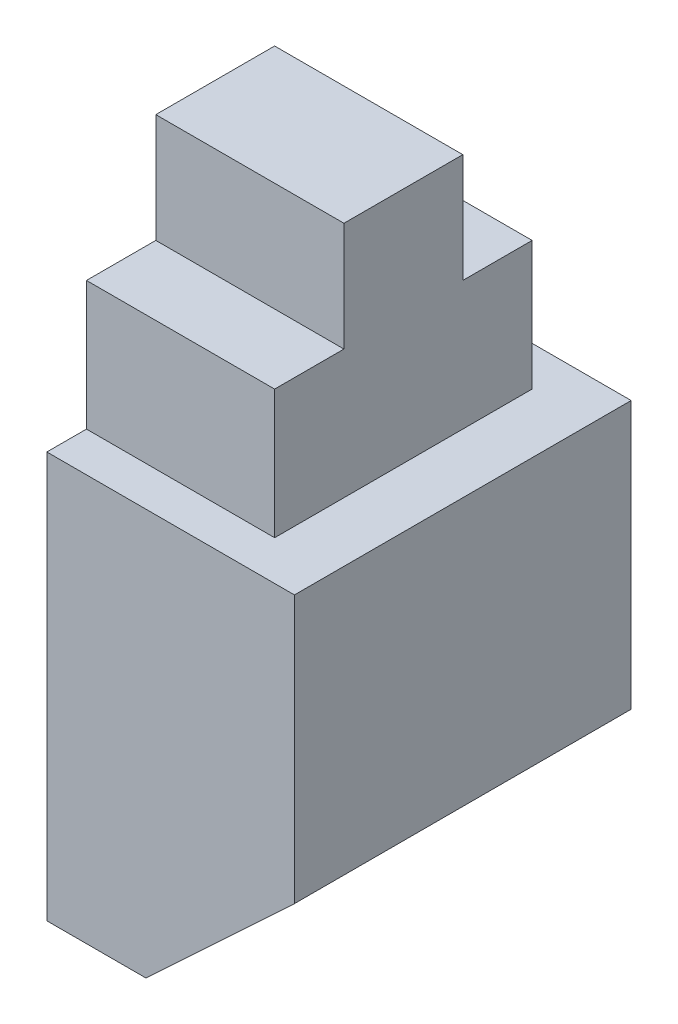
from build123d import *

# Parameters (mm, degrees)
BOSS_EXTRUDE1_DEPTH = 34
BOSS_EXTRUDE2_DEPTH = 19
SKETCH3_W           = 18
SKETCH3_H           = 8
CUT_EXTRUDE1_DEPTH  = 62.329030646


with BuildPart() as part:
    # Sketch1 → Boss-Extrude1 (new body)
    with BuildSketch(Plane.XY):
        Polygon((-12.5, 20.5), (-12.5, -20.5), (-2.5, -20.5), (12.5, -6.5), (12.5, 20.5), align=None)
    extrude(amount=-BOSS_EXTRUDE1_DEPTH)

    # Sketch2 → Boss-Extrude2 (add)
    with BuildSketch(Plane.ZY.offset(12.5)):
        Polygon((-30, 20.5), (-30, 33.5), (-23, 33.5), (-23, 44.5), (-11, 44.5), (-11, 33.5), (-4, 33.5), (-4, 20.5), align=None)
    extrude(amount=-BOSS_EXTRUDE2_DEPTH)

    # Sketch3 → Cut-Extrude1 (cut, through all)
    with BuildSketch(Plane.ZY.offset(12.5)):
        with Locations((-17, -16.5)):
            Rectangle(SKETCH3_W, SKETCH3_H)
    extrude(amount=-CUT_EXTRUDE1_DEPTH, mode=Mode.SUBTRACT)


solid = part.part
